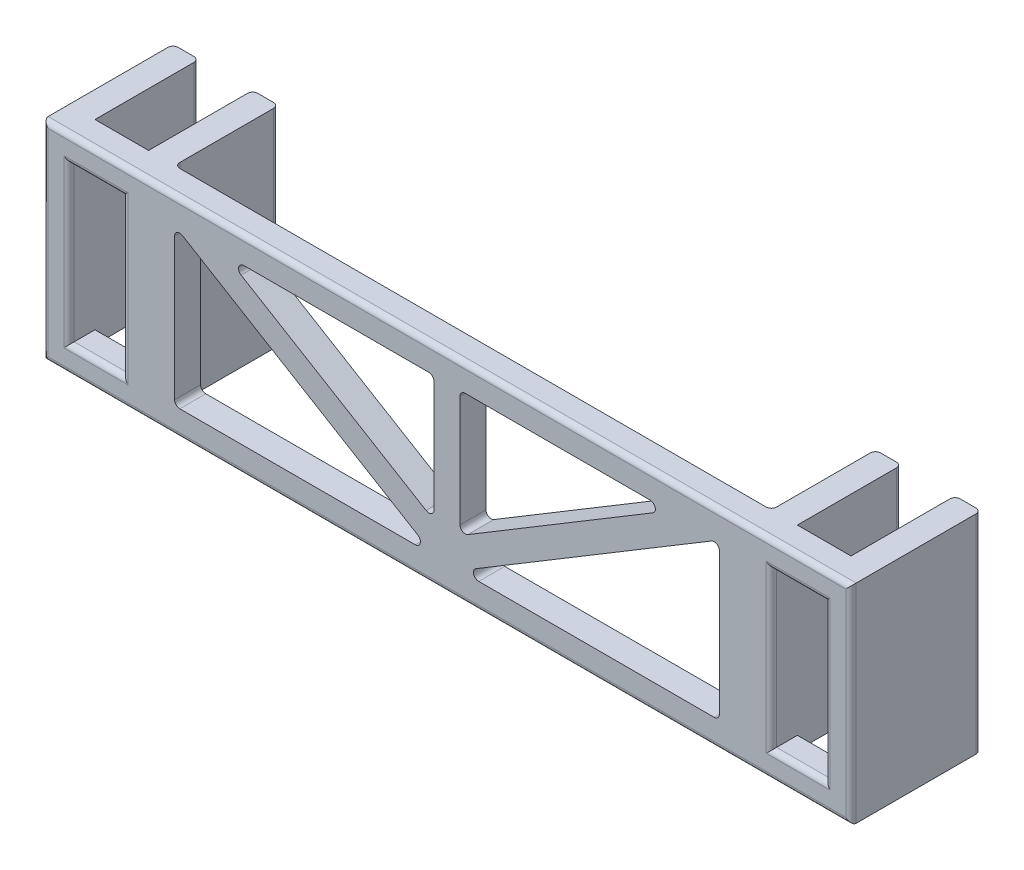
from build123d import *

# Parameters (mm, degrees)
BOSS_EXTRUDE2_DEPTH     = 37.5
BOSS_EXTRUDE3_DEPTH     = 2.5
CUT_EXTRUDE1_DEPTH      = 89.519898893
CUT_EXTRUDE1_DEPTH_BACK = 89.519898893
SKETCH8_W               = 10.3
SKETCH8_H               = 30
CUT_EXTRUDE3_DEPTH      = 89.519898893
FILLET1_R               = 1


with BuildPart() as part:
    # Sketch2 → Boss-Extrude2 (new body)
    with BuildSketch(Plane(origin=(0, 0, 0), x_dir=(1, 0, 0), z_dir=(0, 1, 0))):
        Polygon((77.65, -15), (77.65, 10), (72.65, 10), (72.65, -10), (62.35, -10), (62.35, 10), (57.35, 10), (57.35, -10), (-57.35, -10), (-57.35, 10), (-62.35, 10), (-62.35, -10), (-72.65, -10), (-72.65, 10), (-77.65, 10), (-77.65, -15), align=None)
    extrude(amount=BOSS_EXTRUDE2_DEPTH)

    # Sketch3 → Boss-Extrude3 (add)
    with BuildSketch(Plane(origin=(0, 0, 0), x_dir=(1, 0, 0), z_dir=(0, 1, 0))):
        Polygon((77.65, 10), (77.65, -15), (-77.65, -15), (-77.65, 10), (-75.15, 10), (-75.15, -12.5), (-59.85, -12.5), (-59.85, 10), (-57.35, 10), (-57.35, -10), (57.35, -10), (57.35, 10), (59.85, 10), (59.85, -12.5), (75.15, -12.5), (75.15, 10), align=None)
    extrude(amount=-BOSS_EXTRUDE3_DEPTH)

    # Sketch4 → Cut-Extrude1 (cut, two sides: drawn at the far end of the back side and taken through both)
    with BuildSketch(Plane(origin=(0, 0, 10), x_dir=(-1, 0, 0), z_dir=(0, 0, -1)).offset(-CUT_EXTRUDE1_DEPTH_BACK)):
        Polygon((52.35, 2.5), (52.35, 32.5), (2.5, 2.5), align=None)
        Polygon((-2.5, 2.5), (-52.35, 2.5), (-52.35, 32.5), align=None)
        Polygon((42.653175634, 32.5), (2.5, 8.335601424), (2.5, 32.5), align=None)
        Polygon((-2.5, 8.335601424), (-2.5, 32.5), (-42.653175634, 32.5), align=None)
    extrude(amount=CUT_EXTRUDE1_DEPTH + CUT_EXTRUDE1_DEPTH_BACK, mode=Mode.SUBTRACT)

    # Sketch8 → Cut-Extrude3 (cut, through all)
    with BuildSketch(Plane(origin=(0, 0, 10), x_dir=(-1, 0, 0), z_dir=(0, 0, -1))):
        with Locations((67.5, 17.5)):
            Rectangle(SKETCH8_W, SKETCH8_H)
        with Locations((-67.5, 17.5)):
            Rectangle(SKETCH8_W, SKETCH8_H)
    extrude(amount=-CUT_EXTRUDE3_DEPTH, mode=Mode.SUBTRACT)

    # Fillet1
    fillet1_edges = [part.edges().sort_by_distance(p)[0] for p in [
        (2.5, 8.335601424, 12.5),
        (42.653175634, 32.5, 12.5),
        (2.5, 32.5, 12.5),
        (-52.35, 2.5, 12.5),
        (-2.5, 2.5, 12.5),
        (-52.35, 32.5, 12.5),
        (-2.5, 32.5, 12.5),
        (-42.653175634, 32.5, 12.5),
        (-2.5, 8.335601424, 12.5),
        (52.35, 32.5, 12.5),
        (2.5, 2.5, 12.5),
        (52.35, 2.5, 12.5),
        (-72.65, 17.5, 15),
        (-67.5, 2.5, 15),
        (-62.35, 17.5, 15),
        (-67.5, 32.5, 15),
        (62.35, 17.5, 15),
        (67.5, 2.5, 15),
        (72.65, 17.5, 15),
        (67.5, 32.5, 15),
        (0, 37.5, 15),
        (-62.35, 18.75, -10),
        (-57.35, 17.5, -10),
        (-57.35, 17.5, 10),
        (57.35, 17.5, 10),
        (57.35, 17.5, -10),
        (62.35, 18.75, -10),
        (72.65, 18.75, -10),
        (77.65, 17.5, -10),
        (77.65, 17.5, 15),
        (-77.65, 17.5, 15),
        (-77.65, 17.5, -10),
        (-72.65, 18.75, -10),
        (0, -2.5, 15),
    ]]
    fillet(fillet1_edges, radius=FILLET1_R)


solid = part.part
